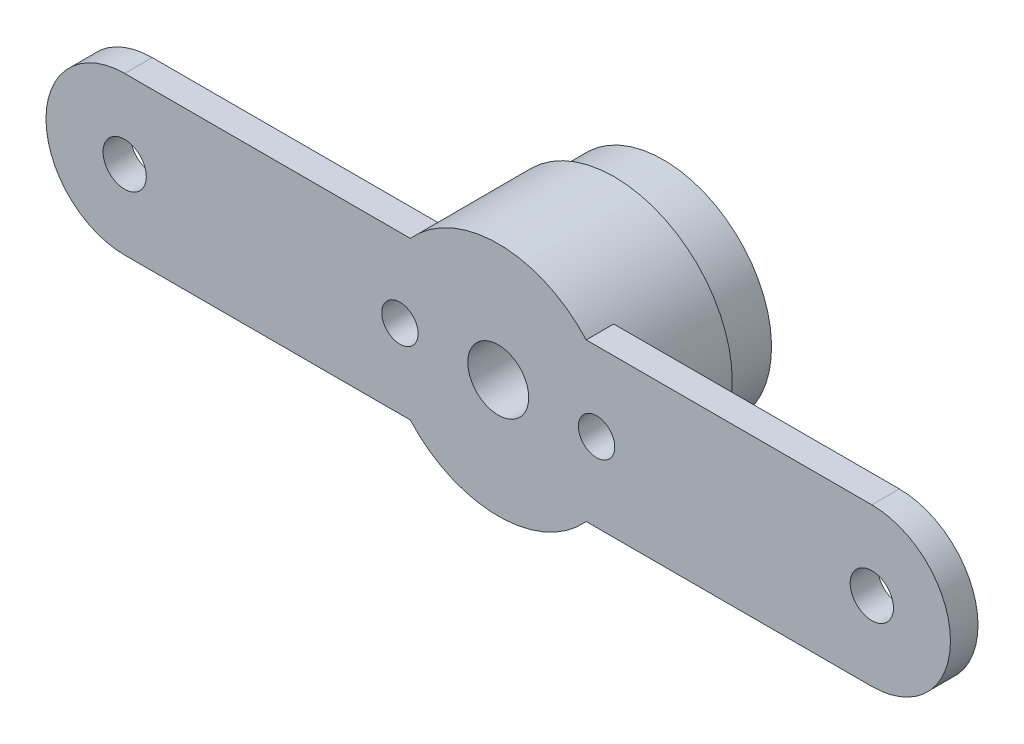
from build123d import *

# Parameters (mm, degrees)
SKETCH_1_R               = 1.55
SKETCH_1_R_2             = 1.1
EXTRUDE_1_DEPTH          = 1.4
EXTRUDE_START            = 4.5
SKETCH_2_R               = 6
EXTRUDE_2_DEPTH          = 4.5
SKETCH_3_R               = 5.5
EXTRUDE_3_DEPTH          = 2.5
SKETCH_5_R               = 0.4
CUT_EXTRUDE_1_DEPTH      = 5
PATTERN_CIRCULAR_2_COUNT = 25
SKETCH_4_R               = 2.6
CUT_EXTRUDE_2_DEPTH      = 5
CUT_EXTRUDE_START        = -30
SKETCH_6_R               = 1.55
CUT_EXTRUDE_3_DEPTH      = 30
SKETCH_7_R               = 0.925
CUT_EXTRUDE_4_DEPTH      = 6
SKETCH_8_W               = 1.6
SKETCH_8_H               = 4.2
CUT_EXTRUDE_5_DEPTH      = 3.2
SKETCH_9_W               = 1.6
SKETCH_9_H               = 4.2
CUT_EXTRUDE_6_DEPTH      = 3.2


with BuildPart() as part:
    # 草图1 → 凸台-拉伸1 (new body)
    with BuildSketch(Plane.XY):
        with BuildLine():
            Line((4.472135955, 4), (19, 4))
            ThreePointArc((19, 4), (23, 0), (19, -4))
            Line((19, -4), (4.472135955, -4))
            ThreePointArc((4.472135955, -4), (0, -6), (-4.472135955, -4))
            Line((-4.472135955, -4), (-19, -4))
            ThreePointArc((-19, -4), (-23, 0), (-19, 4))
            Line((-19, 4), (-4.472135955, 4))
            ThreePointArc((-4.472135955, 4), (0, 6), (4.472135955, 4))
        make_face()
        Circle(SKETCH_1_R, mode=Mode.SUBTRACT)
        with Locations((19, 0)):
            Circle(SKETCH_1_R_2, mode=Mode.SUBTRACT)
        with Locations((-19, 0)):
            Circle(SKETCH_1_R_2, mode=Mode.SUBTRACT)
    extrude(amount=EXTRUDE_1_DEPTH)

    # 草图2 → 凸台-拉伸2 (add)
    with BuildSketch(Plane(origin=(0, 0, 0), x_dir=(-1, 0, 0), z_dir=(0, 0, -1)).offset(EXTRUDE_START)):
        Circle(SKETCH_2_R)
    extrude(amount=-EXTRUDE_2_DEPTH)

    # 草图3 → 凸台-拉伸3 (add)
    with BuildSketch(Plane(origin=(0, 0, -4.5), x_dir=(-1, 0, 0), z_dir=(0, 0, -1))):
        Circle(SKETCH_3_R)
    extrude(amount=EXTRUDE_3_DEPTH)

    # 草图5 → 切除-拉伸1 (cut)
    with BuildSketch(Plane(origin=(0, 0, -7), x_dir=(-1, 0, 0), z_dir=(0, 0, -1))):
        with Locations((0, 2.6)):
            Circle(SKETCH_5_R)
    cut_extrude_1 = extrude(amount=-CUT_EXTRUDE_1_DEPTH, mode=Mode.SUBTRACT)

    # 阵列(圆周)2: 切除-拉伸1 ×25 about axis
    pattern_circular_2_axis = Axis((0, 0, 0), (0, 0, 1))
    for i in range(1, PATTERN_CIRCULAR_2_COUNT):
        add(cut_extrude_1.rotate(pattern_circular_2_axis, i * 360 / PATTERN_CIRCULAR_2_COUNT), mode=Mode.SUBTRACT)

    # 草图4 → 切除-拉伸2 (cut)
    with BuildSketch(Plane(origin=(0, 0, -7), x_dir=(-1, 0, 0), z_dir=(0, 0, -1))):
        Circle(SKETCH_4_R)
    extrude(amount=-CUT_EXTRUDE_2_DEPTH, mode=Mode.SUBTRACT)

    # 草图6 → 切除-拉伸3 (cut)
    with BuildSketch(Plane.XY.offset(1.4).offset(CUT_EXTRUDE_START)):
        with Locations(Location((0, 0, 0), (0, 0, 180))):
            Circle(SKETCH_6_R)
    extrude(amount=CUT_EXTRUDE_3_DEPTH, mode=Mode.SUBTRACT)

    # 草图7 → 切除-拉伸4 (cut)
    with BuildSketch(Plane.XY.offset(1.4)):
        with Locations((5, 0)):
            Circle(SKETCH_7_R)
        with Locations((-5, 0)):
            Circle(SKETCH_7_R)
    extrude(amount=-CUT_EXTRUDE_4_DEPTH, mode=Mode.SUBTRACT)

    # 草图8 → 切除-拉伸5 (cut)
    with BuildSketch(Plane(origin=(6, 0, 0), x_dir=(0, 0, -1), z_dir=(1, 0, 0))):
        with Locations((0.8, 0)):
            Rectangle(SKETCH_8_W, SKETCH_8_H)
    extrude(amount=-CUT_EXTRUDE_5_DEPTH, mode=Mode.SUBTRACT)

    # 草图9 → 切除-拉伸6 (cut)
    with BuildSketch(Plane.ZY.offset(6)):
        with Locations((-0.8, 0)):
            Rectangle(SKETCH_9_W, SKETCH_9_H)
    extrude(amount=-CUT_EXTRUDE_6_DEPTH, mode=Mode.SUBTRACT)


solid = part.part
